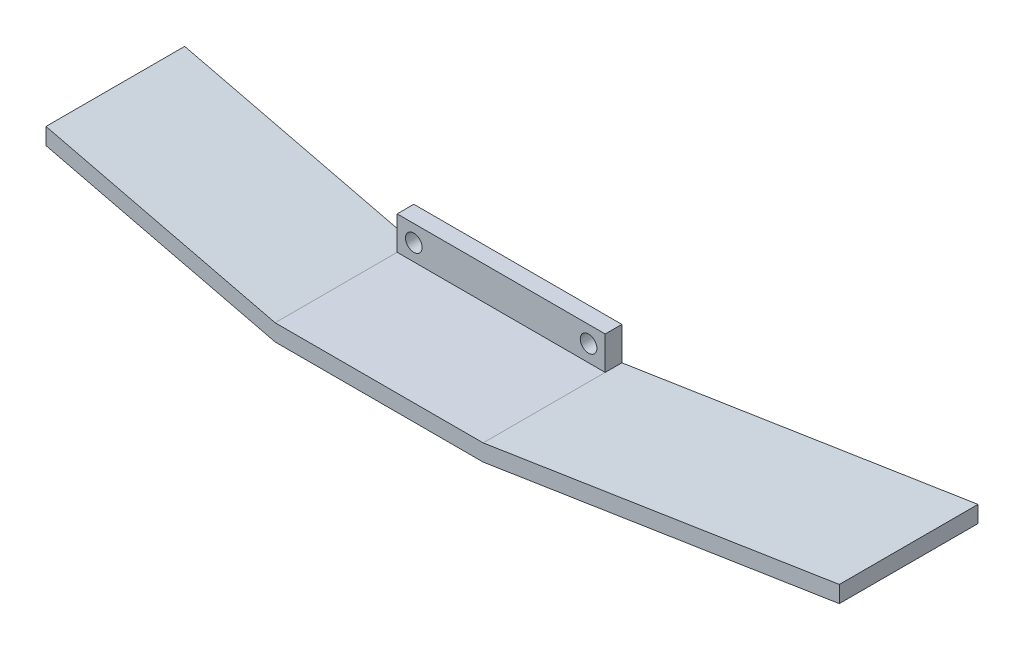
from build123d import *

# Parameters (mm, degrees)
EXTRUDE_2_DEPTH     = 25
SKETCH_3_3_W        = 37.5
SKETCH_3_3_H        = 6
EXTRUDE_3_DEPTH     = 3
SKETCH_4_R          = 1.5
CUT_EXTRUDE_2_DEPTH = 4


with BuildPart() as part:
    # 草图3 → 凸台-拉伸2 (new body)
    with BuildSketch(Plane.XY):
        Polygon((-41.3, 10), (0, 0), (37.5, 0), (101.7, 10), (101.7, 13), (37.5, 3), (0, 3), (-41.3, 13), align=None)
    extrude(amount=EXTRUDE_2_DEPTH)

    # 草图3<3> → 凸台-拉伸3 (add)
    with BuildSketch(Plane.XY):
        with Locations((18.75, 6)):
            Rectangle(SKETCH_3_3_W, SKETCH_3_3_H)
    extrude(amount=EXTRUDE_3_DEPTH)

    # 草图4 → 切除-拉伸2 (cut)
    with BuildSketch(Plane(origin=(0, 0, 0), x_dir=(-1, 0, 0), z_dir=(0, 0, -1))):
        with Locations((-34.5, 6)):
            Circle(SKETCH_4_R)
        with Locations((-3, 6)):
            Circle(SKETCH_4_R)
    extrude(amount=-CUT_EXTRUDE_2_DEPTH, mode=Mode.SUBTRACT)


solid = part.part
